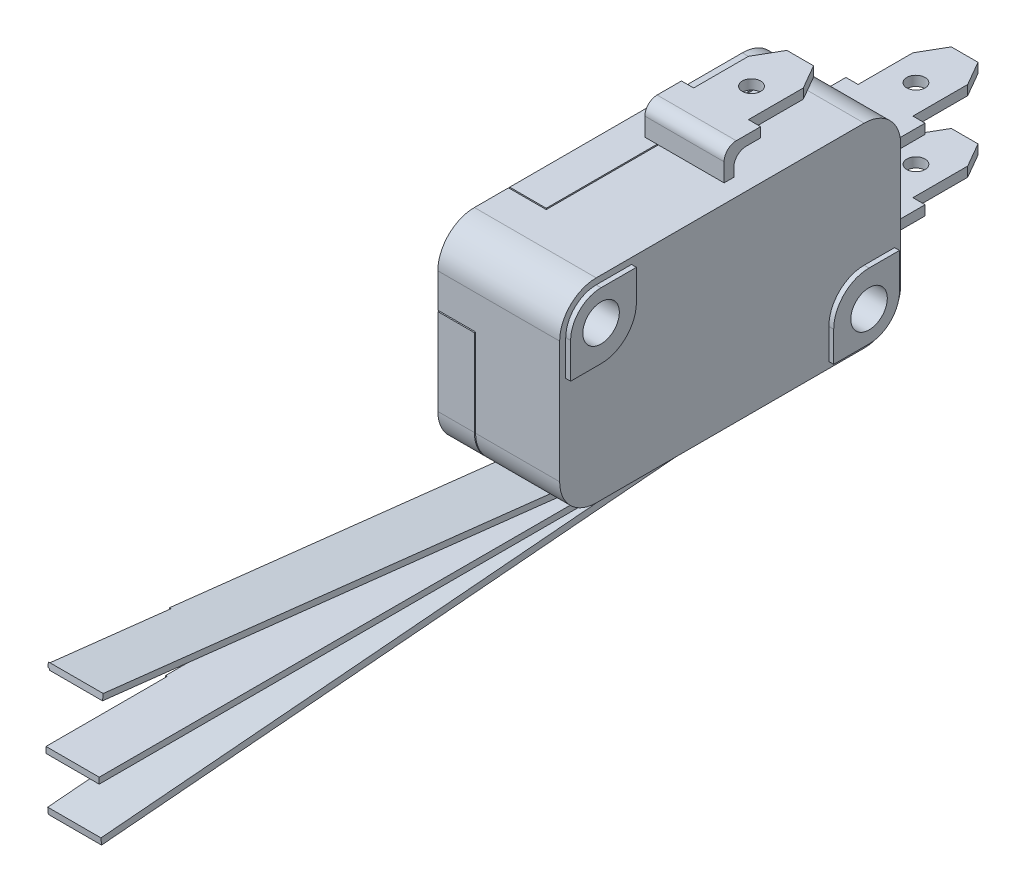
from build123d import *

# Parameters (mm, degrees)
SKETCH_1_W          = 28
SKETCH_1_H          = 16
SKETCH_1_R          = 1.5
EXTRUDE_1_DEPTH     = 10
FILLET_1_R          = 3
SKETCH_2_R          = 1.5
EXTRUDE_2_DEPTH     = 0.4
CUT_EXTRUDE_1_DEPTH = 0.1
CUT_EXTRUDE_2_DEPTH = 3
CUT_EXTRUDE_3_DEPTH = 0.1
CUT_EXTRUDE_4_DEPTH = 0.1
SKETCH_7_W          = 2.9
SKETCH_7_H          = 0.1
CUT_EXTRUDE_5_DEPTH = 0.1
SKETCH_8_W          = 2.9
SKETCH_8_H          = 0.1
CUT_EXTRUDE_6_DEPTH = 0.1
EXTRUDE_3_DEPTH     = 4.5
SKETCH_11_W         = 10
SKETCH_11_H         = 0.8
EXTRUDE_4_DEPTH     = 6.5
SKETCH_12_R         = 0.75
CUT_EXTRUDE_7_DEPTH = 53.388166603
FILLET_2_R          = 1
SKETCH_13_R         = 0.75
CUT_EXTRUDE_8_DEPTH = 2
EXTRUDE_6_DEPTH     = 4.5
EXTRUDE_7_DEPTH     = 4.5
CUT_EXTRUDE_9_DEPTH = 0.13


with BuildPart() as part:
    # 草图1 → 凸台-拉伸1 (new body)
    with BuildSketch(Plane(origin=(0, 0, 0), x_dir=(0, 0, -1), z_dir=(1, 0, 0))):
        Rectangle(SKETCH_1_W, SKETCH_1_H)
        with Locations((11, -5)):
            Circle(SKETCH_1_R, mode=Mode.SUBTRACT)
        with Locations((-11, 5)):
            Circle(SKETCH_1_R, mode=Mode.SUBTRACT)
    extrude(amount=EXTRUDE_1_DEPTH)

    # 圆角1
    fillet_1_edges = [part.edges().sort_by_distance(p)[0] for p in [
        (5, 8, 14),
        (5, 8, -14),
        (5, -8, -14),
        (5, -8, 14),
    ]]
    fillet(fillet_1_edges, radius=FILLET_1_R)

    # 草图2 → 凸台-拉伸2 (add)
    # profile 1 of 2: a face of its own
    with BuildSketch(Plane(origin=(10, 0, 0), x_dir=(0, 0, -1), z_dir=(1, 0, 0))):
        with BuildLine():
            Line((13.5, -5), (13.5, -2.1))
            Line((13.5, -2.1), (11, -2.1))
            ThreePointArc((11, -2.1), (8.949390335, -2.949390335), (8.1, -5))
            Line((8.1, -5), (8.1, -7.5))
            Line((8.1, -7.5), (11, -7.5))
            ThreePointArc((11, -7.5), (12.767766953, -6.767766953), (13.5, -5))
        make_face()
        with Locations((11, -5)):
            Circle(SKETCH_2_R, mode=Mode.SUBTRACT)
    # profile 2 of 2: a face of its own
    with BuildSketch(Plane(origin=(10, 0, 0), x_dir=(0, 0, -1), z_dir=(1, 0, 0))):
        with BuildLine():
            Line((-11, 2.1), (-13.5, 2.1))
            Line((-13.5, 2.1), (-13.5, 5))
            ThreePointArc((-13.5, 5), (-12.767766953, 6.767766953), (-11, 7.5))
            Line((-11, 7.5), (-8.1, 7.5))
            Line((-8.1, 7.5), (-8.1, 5))
            ThreePointArc((-8.1, 5), (-8.949390335, 2.949390335), (-11, 2.1))
        make_face()
        with Locations((-11, 5)):
            Circle(SKETCH_2_R, mode=Mode.SUBTRACT)
    extrude(amount=EXTRUDE_2_DEPTH)

    # 草图3 → 切除-拉伸1 (cut)
    with BuildSketch(Plane.ZY):
        with BuildLine():
            Line((-13.5, -2.1), (-11, -2.1))
            ThreePointArc((-11, -2.1), (-8.949390335, -2.949390335), (-8.1, -5))
            Line((-8.1, -5), (-8.1, -7.5))
            Line((-8.1, -7.5), (-8.1, -8))
            Line((-8.1, -8), (-8.2, -8))
            Line((-8.2, -8), (-8.2, -7.5))
            Line((-8.2, -7.5), (-8.2, -5))
            ThreePointArc((-8.2, -5), (-9.020101013, -3.020101013), (-11, -2.2))
            Line((-11, -2.2), (-13.5, -2.2))
            Line((-13.5, -2.2), (-14, -2.2))
            Line((-14, -2.2), (-14, -2.1))
            Line((-14, -2.1), (-13.5, -2.1))
        make_face()
        with BuildLine():
            Line((13.5, 2.1), (11, 2.1))
            ThreePointArc((11, 2.1), (8.949390335, 2.949390335), (8.1, 5))
            Line((8.1, 5), (8.1, 7.5))
            Line((8.1, 7.5), (8.1, 8))
            Line((8.1, 8), (8.2, 8))
            Line((8.2, 8), (8.2, 7.5))
            Line((8.2, 7.5), (8.2, 5))
            ThreePointArc((8.2, 5), (9.020101013, 3.020101013), (11, 2.2))
            Line((11, 2.2), (13.5, 2.2))
            Line((13.5, 2.2), (14, 2.2))
            Line((14, 2.2), (14, 2.1))
            Line((14, 2.1), (13.5, 2.1))
        make_face()
    extrude(amount=-CUT_EXTRUDE_1_DEPTH, mode=Mode.SUBTRACT)

    # 草图4 → 切除-拉伸2 (cut)
    with BuildSketch(Plane(origin=(0, 8, 0), x_dir=(1, 0, 0), z_dir=(0, 1, 0))):
        Polygon((0, -8.2), (3.1, -8.2), (3.1, 14), (3, 14), (3, -8.1), (0, -8.1), align=None)
    extrude(amount=-CUT_EXTRUDE_2_DEPTH, mode=Mode.SUBTRACT)

    # 草图5 → 切除-拉伸3 (cut)
    with BuildSketch(Plane(origin=(0, 0, -14), x_dir=(-1, 0, 0), z_dir=(0, 0, -1))):
        Polygon((-3, 5), (-3, -2.1), (-0.1, -2.1), (-0.1, -2.2), (-3.1, -2.2), (-3.1, 5), align=None)
    extrude(amount=-CUT_EXTRUDE_3_DEPTH, mode=Mode.SUBTRACT)

    # 草图6 → 切除-拉伸4 (cut)
    with BuildSketch(Plane.ZY.offset(-3.1)):
        with BuildLine():
            Line((-8.2, -8), (11, -8))
            ThreePointArc((11, -8), (13.121320344, -7.121320344), (14, -5))
            Line((14, -5), (14, 2.1))
            Line((14, 2.1), (14, 2.2))
            Line((14, 2.2), (13.9, 2.2))
            Line((13.9, 2.2), (13.9, 2.1))
            Line((13.9, 2.1), (13.9, -5))
            ThreePointArc((13.9, -5), (13.050609665, -7.050609665), (11, -7.9))
            Line((11, -7.9), (-8.2, -7.9))
            Line((-8.2, -7.9), (-8.2, -8))
        make_face()
    extrude(amount=CUT_EXTRUDE_4_DEPTH, mode=Mode.SUBTRACT)

    # 草图7 → 切除-拉伸5 (cut)
    with BuildSketch(Plane.XY.offset(14)):
        with Locations((1.55, 2.15)):
            Rectangle(SKETCH_7_W, SKETCH_7_H)
    extrude(amount=-CUT_EXTRUDE_5_DEPTH, mode=Mode.SUBTRACT)

    # 草图8 → 切除-拉伸6 (cut)
    with BuildSketch(Plane.XZ.offset(8)):
        with Locations((1.55, -8.15)):
            Rectangle(SKETCH_8_W, SKETCH_8_H)
    extrude(amount=-CUT_EXTRUDE_6_DEPTH, mode=Mode.SUBTRACT)

    # 草图10 → 凸台-拉伸3 (add)
    with BuildSketch(Plane.ZY.offset(-3.1)):
        Polygon((-2.6, -8), (-2.6, -10), (49.4, -10), (49.4, -9.5), (-2.1, -9.5), (-2.1, -8), align=None)
        with BuildLine():
            Line((11, -8.08), (11, -8))
            Line((11, -8), (8.2, -8))
            Line((8.2, -8), (8.2, -8.08))
            ThreePointArc((8.2, -8.08), (9.6, -9.48), (11, -8.08))
        make_face()
    extrude(amount=-EXTRUDE_3_DEPTH)

    # 草图11 → 凸台-拉伸4 (add)
    with BuildSketch(Plane.ZY.offset(-2)):
        with Locations((-19, 3.6)):
            Rectangle(SKETCH_11_W, SKETCH_11_H)
        with Locations((-19, -2.2)):
            Rectangle(SKETCH_11_W, SKETCH_11_H)
        Polygon((-1, 8), (-1, 10.5), (-10.5, 10.5), (-10.5, 9.7), (-1.8, 9.7), (-1.8, 8), align=None)
    extrude(amount=-EXTRUDE_4_DEPTH)

    # 草图12 → 切除-拉伸7 (cut, through all)
    with BuildSketch(Plane(origin=(0, 4, 0), x_dir=(1, 0, 0), z_dir=(0, 1, 0))):
        with Locations(Location((5.25, 20, 0), (0, 0, 270))):
            Circle(SKETCH_12_R)
        Polygon((2, 17.5), (3, 17.5), (3, 22), (4.154700538, 24), (3, 24), (2, 24), align=None)
        Polygon((8.5, 24), (8.5, 17.5), (7.5, 17.5), (7.5, 22), (6.345299462, 24), (7.5, 24), align=None)
    extrude(amount=-CUT_EXTRUDE_7_DEPTH, mode=Mode.SUBTRACT)

    # 圆角2
    fillet_2_edges = [part.edges().sort_by_distance(p)[0] for p in [
        (5.35, -10, -2.6),
        (5.35, -9.5, -2.1),
        (5.25, 9.7, -1.8),
        (5.25, 10.5, -1),
    ]]
    fillet(fillet_2_edges, radius=FILLET_2_R)

    # 草图13 → 切除-拉伸8 (cut)
    with BuildSketch(Plane(origin=(0, 10.5, 0), x_dir=(1, 0, 0), z_dir=(0, 1, 0))):
        with Locations(Location((5.25, 6.5, 0), (0, 0, 270))):
            Circle(SKETCH_13_R)
        Polygon((8.5, 10.5), (6.345299462, 10.5), (7.5, 8.5), (7.5, 4), (8.5, 4), align=None)
        Polygon((3, 4), (2, 4), (2, 10.5), (4.154700538, 10.5), (3, 8.5), align=None)
    extrude(amount=-CUT_EXTRUDE_8_DEPTH, mode=Mode.SUBTRACT)

    # 草图10<5> → 凸台-拉伸6 (add)
    with BuildSketch(Plane.ZY.offset(-3.1)):
        with BuildLine():
            Line((8.223055296, -8.333028221), (-2.1, -9.5))
            Line((-2.1, -9.5), (2.351181411, -9.5))
            Line((2.351181411, -9.5), (8.408603451, -8.815237556))
            ThreePointArc((8.408603451, -8.815237556), (8.293391543, -8.582766687), (8.223055296, -8.333028221))
        make_face()
        with BuildLine():
            ThreePointArc((11, -8.08), (10.981240109, -8.308420142), (10.925463198, -8.53071866))
            Line((10.925463198, -8.53071866), (49.130220738, -4.211854469))
            Line((49.130220738, -4.211854469), (49.074055873, -3.715018975))
            Line((49.074055873, -3.715018975), (11.77713938, -7.9312561))
            Line((11.77713938, -7.9312561), (11.77713938, -7.9812561))
            Line((11.77713938, -7.9812561), (11, -8.069107971))
            Line((11, -8.069107971), (11, -8.08))
        make_face()
    extrude(amount=-EXTRUDE_6_DEPTH)

    # 草图10<6> → 凸台-拉伸7 (add)
    with BuildSketch(Plane.ZY.offset(-3.1)):
        Polygon((3.75, -10), (-2.6, -10), (49.2111008, -14.428299214), (49.257152, -13.889500171), (9.6, -10.5), align=None)
    extrude(amount=-EXTRUDE_7_DEPTH)

    # 草图14 → 切除-拉伸9 (cut)
    with BuildSketch(Plane.ZY.offset(-3.1)):
        with BuildLine():
            Line((39.135085265, -4.838571826), (49.072235928, -3.715224711))
            ThreePointArc((49.072235928, -3.715224711), (49.444709047, -9.069072224), (49.263942313, -14.432815582))
            Line((49.263942313, -14.432815582), (39.300269083, -13.58121958))
            ThreePointArc((39.300269083, -13.58121958), (39.445530044, -9.205590645), (39.135085265, -4.838571826))
        make_face()
    extrude(amount=-CUT_EXTRUDE_9_DEPTH, mode=Mode.SUBTRACT)


solid = part.part
